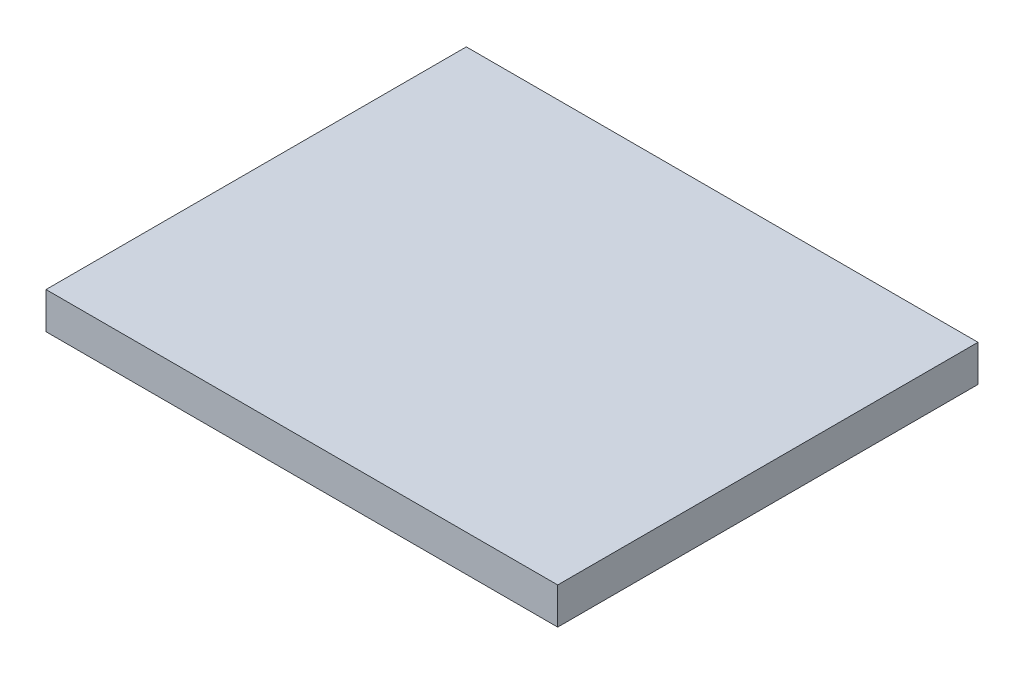
from build123d import *

# Parameters (mm, degrees)
SKETCH1_W           = 140
SKETCH1_H           = 115
BOSS_EXTRUDE1_DEPTH = 10


with BuildPart() as part:
    # Sketch1 → Boss-Extrude1 (new body)
    with BuildSketch(Plane(origin=(0, 0, 0), x_dir=(1, 0, 0), z_dir=(0, 1, 0))):
        Rectangle(SKETCH1_W, SKETCH1_H)
    extrude(amount=BOSS_EXTRUDE1_DEPTH)


solid = part.part
